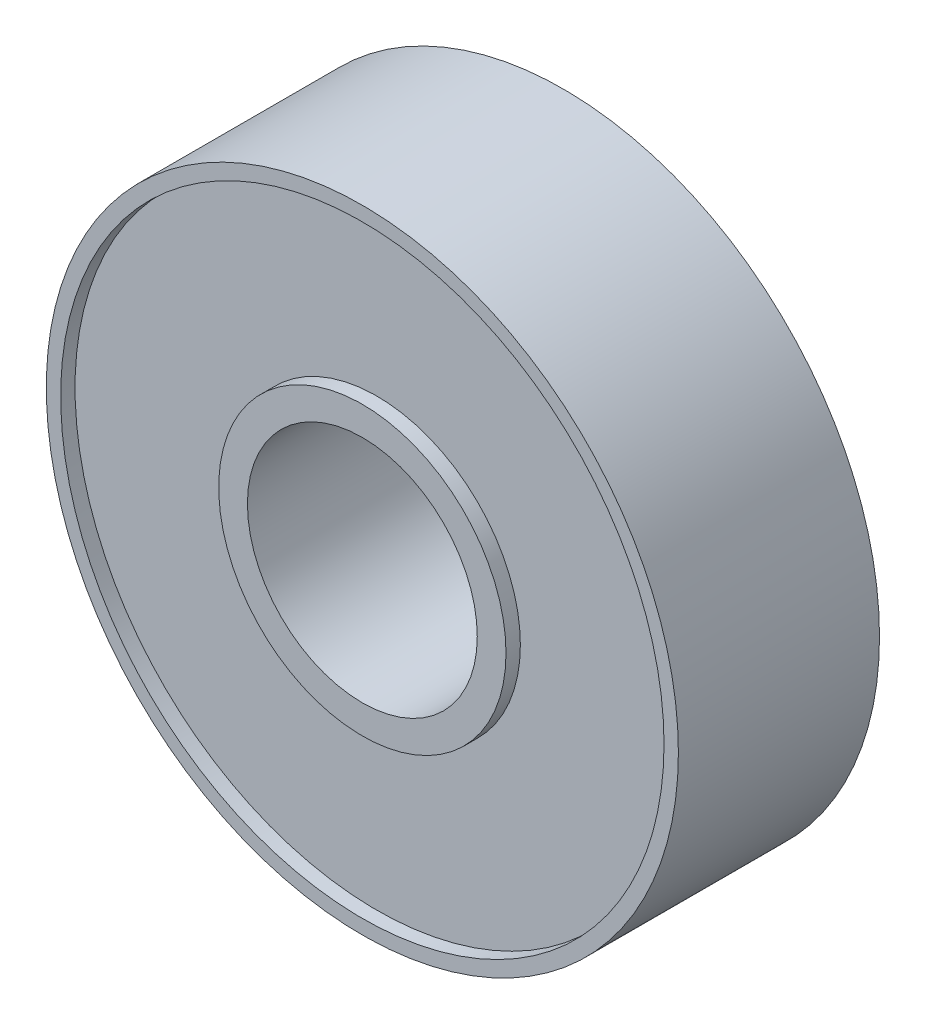
from build123d import *

# Parameters (mm, degrees)
SKETCH1_R           = 11
SKETCH1_R_2         = 4
BOSS_EXTRUDE1_DEPTH = 3.5
SKETCH2_R           = 10.5
SKETCH2_R_2         = 5
CUT_EXTRUDE1_DEPTH  = 0.5


with BuildPart() as part:
    # Sketch1 → Boss-Extrude1 (new, symmetric)
    with BuildSketch(Plane.XY):
        Circle(SKETCH1_R)
        Circle(SKETCH1_R_2, mode=Mode.SUBTRACT)
    extrude(amount=BOSS_EXTRUDE1_DEPTH, both=True)

    # Sketch2 → Cut-Extrude1 (cut)
    with BuildSketch(Plane.XY.offset(3.5)):
        Circle(SKETCH2_R)
        Circle(SKETCH2_R_2, mode=Mode.SUBTRACT)
    cut_extrude1 = extrude(amount=-CUT_EXTRUDE1_DEPTH, mode=Mode.SUBTRACT)

    # Mirror1: Cut-Extrude1 across plane
    add(cut_extrude1.mirror(Plane.XY), mode=Mode.SUBTRACT)


solid = part.part
